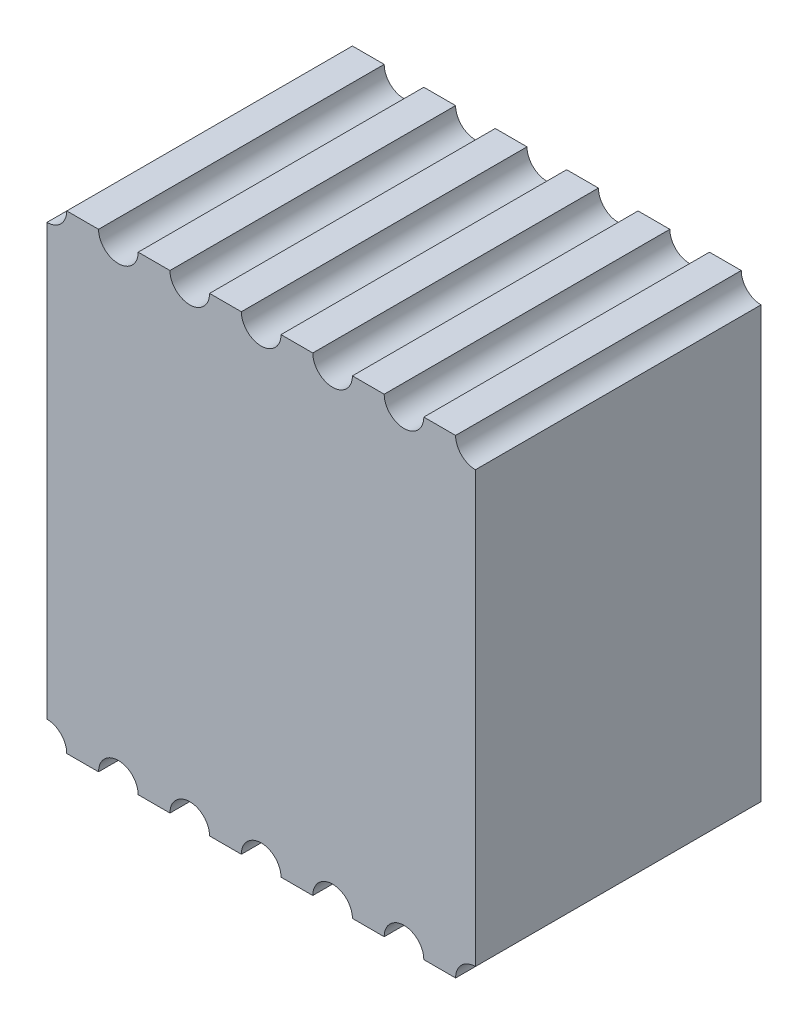
from build123d import *

# Parameters (mm, degrees)
BOSS_EXTRUDE1_DEPTH = 8


with BuildPart() as part:
    # Sketch1 → Boss-Extrude1 (new body)
    with BuildSketch(Plane.XY):
        with BuildLine():
            Line((11.445, 13.16), (10.555, 13.16))
            ThreePointArc((10.555, 13.16), (10, 12.605), (9.445, 13.16))
            Line((9.445, 13.16), (8.555, 13.16))
            ThreePointArc((8.555, 13.16), (8, 12.605), (7.445, 13.16))
            Line((7.445, 13.16), (6.555, 13.16))
            ThreePointArc((6.555, 13.16), (6, 12.605), (5.445, 13.16))
            Line((5.445, 13.16), (4.555, 13.16))
            ThreePointArc((4.555, 13.16), (4, 12.605), (3.445, 13.16))
            Line((3.445, 13.16), (2.555, 13.16))
            ThreePointArc((2.555, 13.16), (2, 12.605), (1.445, 13.16))
            Line((1.445, 13.16), (0.555, 13.16))
            ThreePointArc((0.555, 13.16), (0.392444264, 12.767555736), (0, 12.605))
            Line((0, 12.605), (0, 0.555))
            ThreePointArc((0, 0.555), (0.392444264, 0.392444264), (0.555, 0))
            Line((0.555, 0), (1.445, 0))
            ThreePointArc((1.445, 0), (2, 0.555), (2.555, 0))
            Line((2.555, 0), (3.445, 0))
            ThreePointArc((3.445, 0), (4, 0.555), (4.555, 0))
            Line((4.555, 0), (5.445, 0))
            ThreePointArc((5.445, 0), (6, 0.555), (6.555, 0))
            Line((6.555, 0), (7.445, 0))
            ThreePointArc((7.445, 0), (8, 0.555), (8.555, 0))
            Line((8.555, 0), (9.445, 0))
            ThreePointArc((9.445, 0), (10, 0.555), (10.555, 0))
            Line((10.555, 0), (11.445, 0))
            ThreePointArc((11.445, 0), (11.607555736, 0.392444264), (12, 0.555))
            Line((12, 0.555), (12, 12.605))
            ThreePointArc((12, 12.605), (11.607555736, 12.767555736), (11.445, 13.16))
        make_face()
    extrude(amount=BOSS_EXTRUDE1_DEPTH)


solid = part.part
